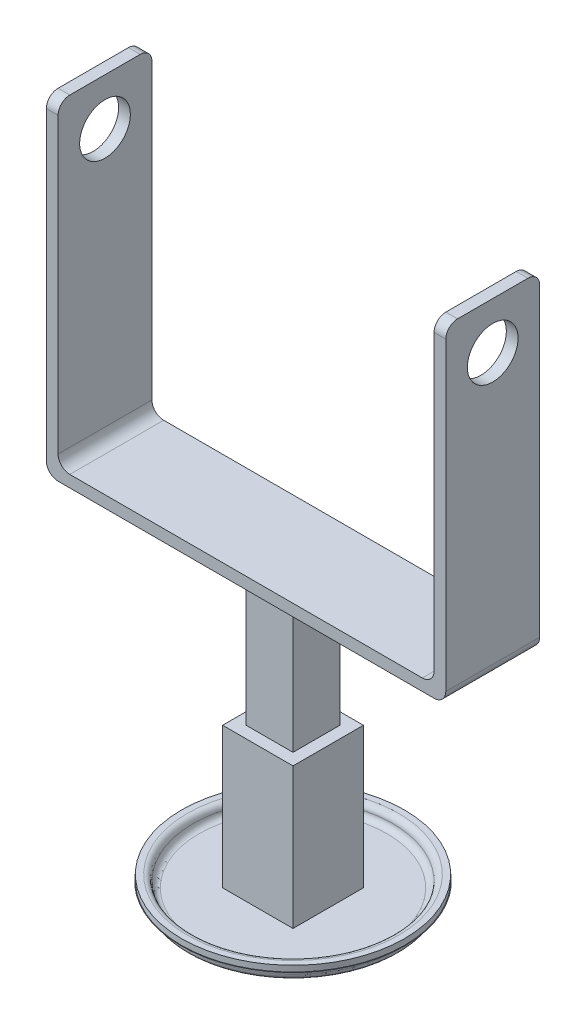
from build123d import *

# Parameters (mm, degrees)
SKETCH3_W           = 38.1
SKETCH3_H           = 38.1
BOSS_EXTRUDE1_DEPTH = 76.2
SKETCH4_W           = 25.4
SKETCH4_H           = 25.4
BOSS_EXTRUDE2_DEPTH = 76.2
BOSS_EXTRUDE3_DEPTH = 25.4
FILLET1_R           = 6.35
FILLET2_R           = 6.35
FILLET3_R           = 6.35
FILLET4_R           = 6.35
SKETCH6_R           = 13.716
CUT_EXTRUDE1_DEPTH  = 402.914443233


with BuildPart() as part:
    # Sketch2 → Revolve1 (revolve)
    with BuildSketch(Plane.XY, mode=Mode.PRIVATE) as revolve1_sk:
        with BuildLine():
            Line((0, 0), (54.261693079, 0))
            ThreePointArc((54.261693079, 0), (56.506757109, 0.92993597), (57.436693079, 3.175))
            ThreePointArc((57.436693079, 3.175), (58.366629049, 5.42006403), (60.611693079, 6.35))
            Line((60.611693079, 6.35), (60.325, 6.35))
            Line((60.325, 6.35), (60.325, 9.525))
            Line((60.325, 9.525), (57.15, 9.525))
            ThreePointArc((57.15, 9.525), (54.90493597, 8.59506403), (53.975, 6.35))
            ThreePointArc((53.975, 6.35), (53.04506403, 4.10493597), (50.8, 3.175))
            Line((50.8, 3.175), (0, 3.175))
            Line((0, 3.175), (0, 0))
        make_face()
    revolve(revolve1_sk.sketch.rotate(Axis((0, 3.175, 0), (0, -1, 0)), 180), axis=Axis((0, 3.175, 0), (0, -1, 0)))

    # Sketch3 → Boss-Extrude1 (add)
    with BuildSketch(Plane(origin=(0, 3.175, 0), x_dir=(1, 0, 0), z_dir=(0, 1, 0))):
        Rectangle(SKETCH3_W, SKETCH3_H)
    extrude(amount=BOSS_EXTRUDE1_DEPTH)

    # Sketch4 → Boss-Extrude2 (add)
    with BuildSketch(Plane(origin=(0, 79.375, 0), x_dir=(1, 0, 0), z_dir=(0, 1, 0))):
        Rectangle(SKETCH4_W, SKETCH4_H)
    extrude(amount=BOSS_EXTRUDE2_DEPTH)

    # Sketch5 → Boss-Extrude3 (add, symmetric)
    with BuildSketch(Plane.XY):
        Polygon((108.077, 155.575), (-108.077, 155.575), (-108.077, 333.375), (-101.727, 333.375), (-101.727, 161.925), (101.727, 161.925), (101.727, 333.375), (108.077, 333.375), align=None)
    extrude(amount=BOSS_EXTRUDE3_DEPTH, both=True)

    # Fillet1
    fillet1_edges = [part.edges().sort_by_distance(p)[0] for p in [
        (101.727, 161.925, 0),
    ]]
    fillet(fillet1_edges, radius=FILLET1_R)

    # Fillet2
    fillet2_edges = [part.edges().sort_by_distance(p)[0] for p in [
        (-101.727, 161.925, 0),
    ]]
    fillet(fillet2_edges, radius=FILLET2_R)

    # Fillet3
    fillet3_edges = [part.edges().sort_by_distance(p)[0] for p in [
        (-108.077, 155.575, 0),
        (108.077, 155.575, 0),
    ]]
    fillet(fillet3_edges, radius=FILLET3_R)

    # Fillet4
    fillet4_edges = [part.edges().sort_by_distance(p)[0] for p in [
        (-104.902, 333.375, -25.4),
        (104.902, 333.375, -25.4),
        (-104.902, 333.375, 25.4),
        (104.902, 333.375, 25.4),
    ]]
    fillet(fillet4_edges, radius=FILLET4_R)

    # Sketch6 → Cut-Extrude1 (cut, through all)
    with BuildSketch(Plane(origin=(108.077, 0, 0), x_dir=(0, 0, -1), z_dir=(1, 0, 0))):
        with Locations((0, 307.975)):
            Circle(SKETCH6_R)
    extrude(amount=-CUT_EXTRUDE1_DEPTH, mode=Mode.SUBTRACT)


solid = part.part
